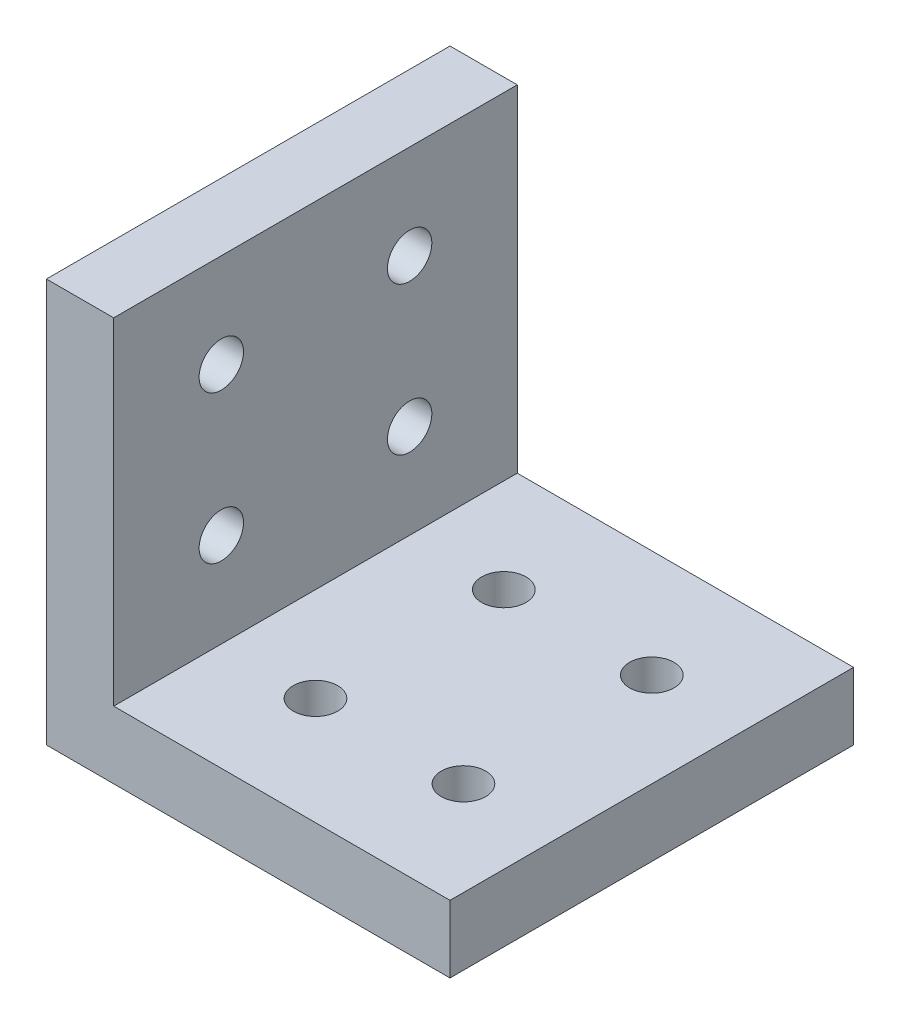
from build123d import *

# Parameters (mm, degrees)
EXTRUDE_1_DEPTH     = 30
SKETCH_2_R          = 1.65
CUT_EXTRUDE_1_DEPTH = 40
SKETCH_3_R          = 1.65
CUT_EXTRUDE_2_DEPTH = 40


with BuildPart() as part:
    # 草图1 → 凸台-拉伸1 (new body)
    with BuildSketch(Plane.XY):
        Polygon((0, 30), (0, 0), (30, 0), (30, 5), (5, 5), (5, 30), align=None)
    extrude(amount=EXTRUDE_1_DEPTH)

    # 草图2 → 切除-拉伸1 (cut)
    with BuildSketch(Plane(origin=(0, 5, 0), x_dir=(1, 0, 0), z_dir=(0, 1, 0))):
        with Locations(Location((23, -8, 0), (0, 0, 180))):
            Circle(SKETCH_2_R)
        with Locations(Location((23, -22, 0), (0, 0, 180))):
            Circle(SKETCH_2_R)
        with Locations(Location((12, -8, 0), (0, 0, 180))):
            Circle(SKETCH_2_R)
        with Locations(Location((12, -22, 0), (0, 0, 180))):
            Circle(SKETCH_2_R)
    extrude(amount=-CUT_EXTRUDE_1_DEPTH, mode=Mode.SUBTRACT)

    # 草图3 → 切除-拉伸2 (cut)
    with BuildSketch(Plane(origin=(5, 0, 0), x_dir=(0, 0, -1), z_dir=(1, 0, 0))):
        with Locations(Location((-22, 23, 0), (0, 0, 90))):
            Circle(SKETCH_3_R)
        with Locations(Location((-22, 12, 0), (0, 0, 90))):
            Circle(SKETCH_3_R)
        with Locations(Location((-8, 23, 0), (0, 0, 90))):
            Circle(SKETCH_3_R)
        with Locations(Location((-8, 12, 0), (0, 0, 90))):
            Circle(SKETCH_3_R)
    extrude(amount=-CUT_EXTRUDE_2_DEPTH, mode=Mode.SUBTRACT)


solid = part.part
